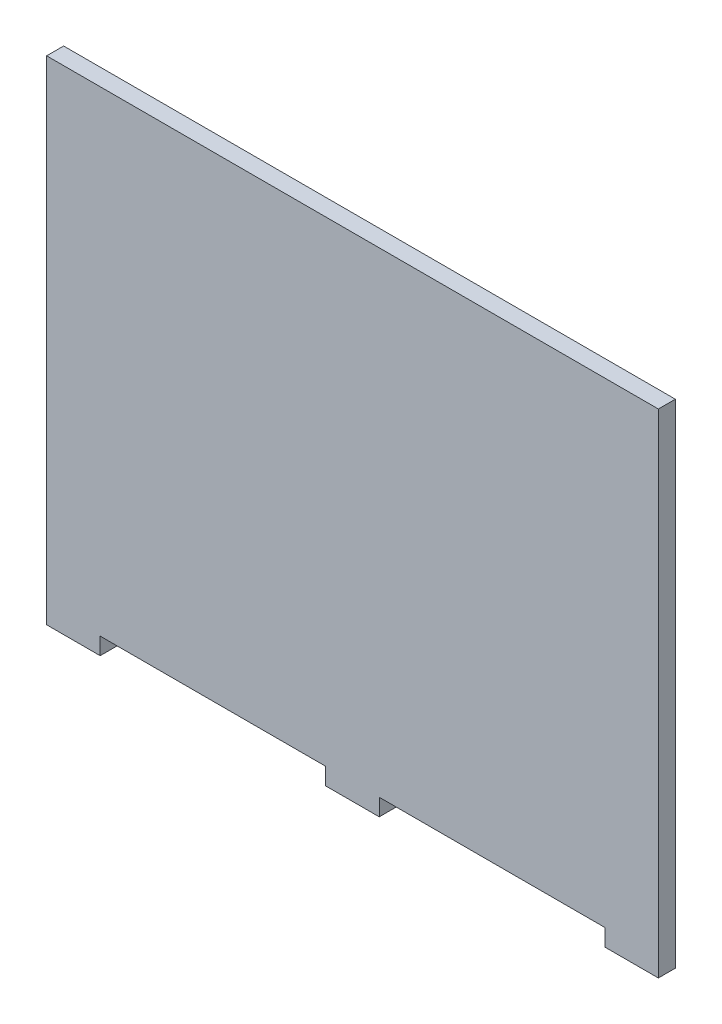
from build123d import *

# Parameters (mm, degrees)
BOSS_EXTRUDE1_DEPTH = 6.35


with BuildPart() as part:
    # Sketch1 → Boss-Extrude1 (new body)
    with BuildSketch(Plane.XY):
        Polygon((114.3, -6.35), (114.3, 0), (114.3, 177.8), (-114.3, 177.8), (-114.3, 0), (-114.3, -6.35), (-94.3, -6.35), (-94.3, 0), (-10, 0), (-10, -6.35), (10, -6.35), (10, 0), (94.3, 0), (94.3, -6.35), align=None)
    extrude(amount=-BOSS_EXTRUDE1_DEPTH)


solid = part.part
